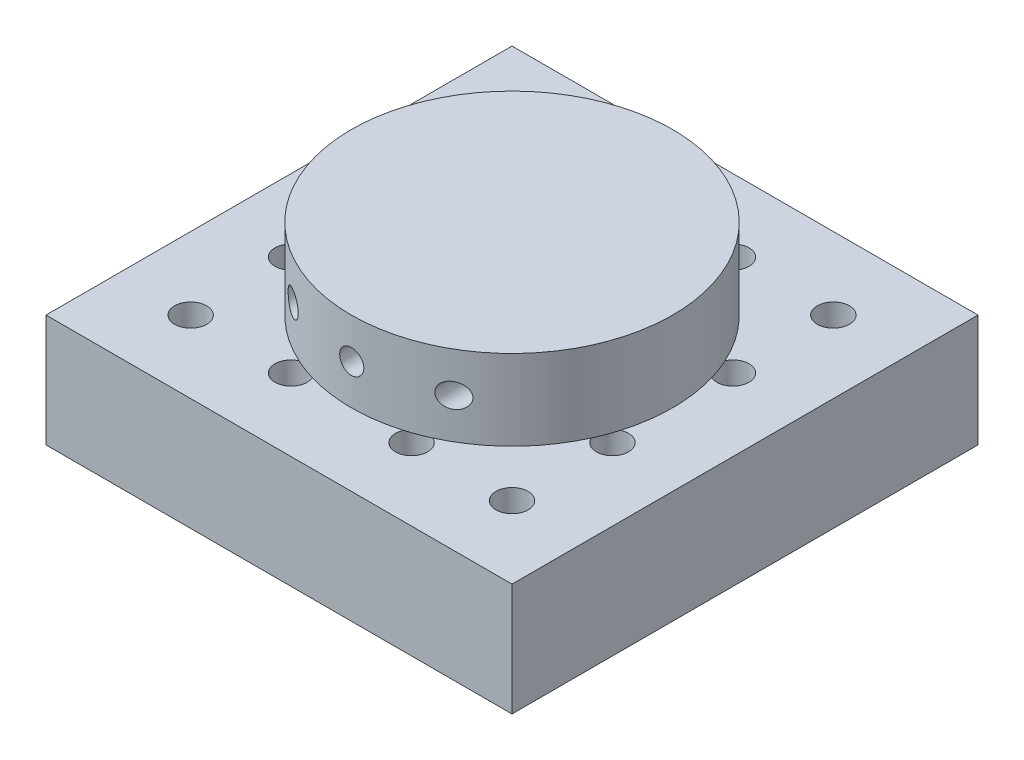
from build123d import *

# Parameters (mm, degrees)
SKETCH_4_W               = 58
SKETCH_4_H               = 58
EXTRUDE_3_DEPTH          = 14
SKETCH_6_R               = 20
EXTRUDE_4_DEPTH          = 10
CUT_EXTRUDE_1_DEPTH      = 30
CUT_EXTRUDE_1_DEPTH_BACK = 30
SKETCH_7_R               = 1.5
SKETCH_8_R               = 2
CUT_EXTRUDE_2_DEPTH      = 14


with BuildPart() as part:
    # 草图4 → 凸台-拉伸3 (new body)
    with BuildSketch(Plane(origin=(0, 0, 0), x_dir=(1, 0, 0), z_dir=(0, 1, 0))):
        Rectangle(SKETCH_4_W, SKETCH_4_H)
    extrude(amount=EXTRUDE_3_DEPTH)

    # 草图6 → 凸台-拉伸4 (add)
    with BuildSketch(Plane(origin=(0, 14, 0), x_dir=(1, 0, 0), z_dir=(0, 1, 0))):
        with Locations(Location((0, 0, 0), (0, 0, 270))):
            Circle(SKETCH_6_R)
    extrude(amount=EXTRUDE_4_DEPTH)

    # 草图7 → 切除-拉伸1 (cut, two sides: drawn at the far end of the back side and taken through both)
    with BuildSketch(Plane.XY.offset(-CUT_EXTRUDE_1_DEPTH_BACK)):
        with Locations(Location((-10, 19, 0), (0, 0, 180))):
            Circle(SKETCH_7_R)
        with Locations(Location((10, 19, 0), (0, 0, 180))):
            Circle(SKETCH_7_R)
        with Locations(Location((0, 19, 0), (0, 0, 180))):
            Circle(SKETCH_7_R)
    extrude(amount=CUT_EXTRUDE_1_DEPTH + CUT_EXTRUDE_1_DEPTH_BACK, mode=Mode.SUBTRACT)

    # 草图8 → 切除-拉伸2 (cut)
    with BuildSketch(Plane.XZ):
        with Locations(Location((-7.5, 7.5, 0), (0, 0, 270))):
            Circle(SKETCH_8_R)
        with Locations(Location((7.5, 7.5, 0), (0, 0, 270))):
            Circle(SKETCH_8_R)
        with Locations(Location((-20, 20, 0), (0, 0, 270))):
            Circle(SKETCH_8_R)
        with Locations(Location((20, 20, 0), (0, 0, 270))):
            Circle(SKETCH_8_R)
        with Locations(Location((-20, -20, 0), (0, 0, 270))):
            Circle(SKETCH_8_R)
        with Locations(Location((-7.5, -7.5, 0), (0, 0, 270))):
            Circle(SKETCH_8_R)
        with Locations(Location((7.5, -7.5, 0), (0, 0, 270))):
            Circle(SKETCH_8_R)
        with Locations(Location((20, -20, 0), (0, 0, 270))):
            Circle(SKETCH_8_R)
        with Locations(Location((-20, 7.5, 0), (0, 0, 270))):
            Circle(SKETCH_8_R)
        with Locations(Location((-20, -7.5, 0), (0, 0, 270))):
            Circle(SKETCH_8_R)
        with Locations(Location((-7.5, -20, 0), (0, 0, 270))):
            Circle(SKETCH_8_R)
        with Locations(Location((7.5, -20, 0), (0, 0, 270))):
            Circle(SKETCH_8_R)
        with Locations(Location((20, -7.5, 0), (0, 0, 270))):
            Circle(SKETCH_8_R)
        with Locations(Location((20, 7.5, 0), (0, 0, 270))):
            Circle(SKETCH_8_R)
        with Locations(Location((-7.5, 20, 0), (0, 0, 270))):
            Circle(SKETCH_8_R)
        with Locations(Location((7.5, 20, 0), (0, 0, 270))):
            Circle(SKETCH_8_R)
    extrude(amount=-CUT_EXTRUDE_2_DEPTH, mode=Mode.SUBTRACT)


solid = part.part
